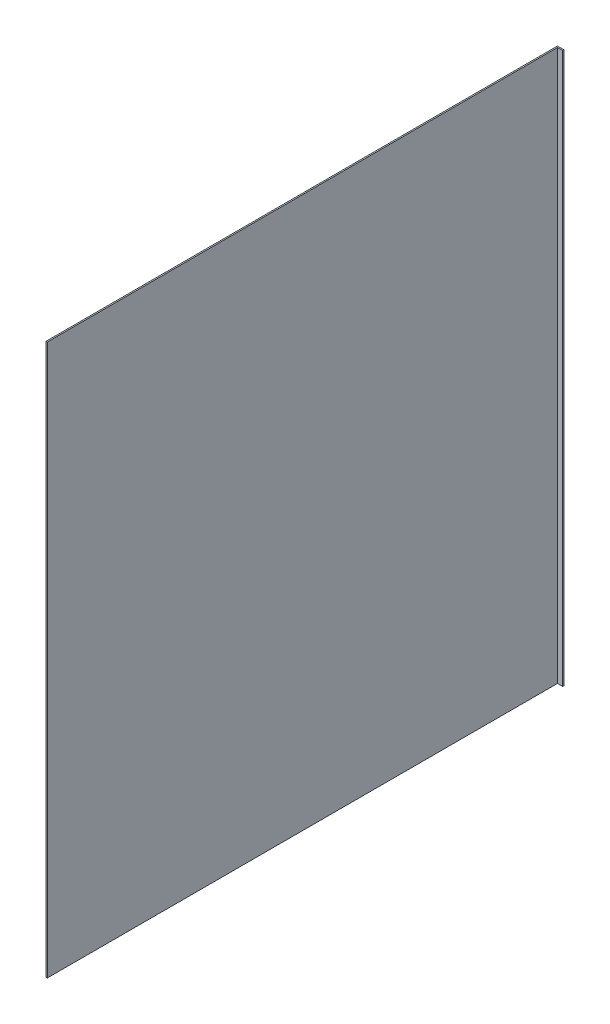
from build123d import *

# Parameters (mm, degrees)
PACK_SARJOR_L_KILAVUZ_1_1_START = 1040
PACK_SARJOR_L_KILAVUZ_1_1_DEPTH = 840


with BuildPart() as part:
    # Sketch1 → PACK_sarjor_L_kilavuz_1_1 (new body)
    with BuildSketch(Plane(origin=(0, 0, 0), x_dir=(1, 0, 0), z_dir=(0, 1, 0)).offset(PACK_SARJOR_L_KILAVUZ_1_1_START)):
        Polygon((140, 800), (150, 800), (150, 798), (142, 798), (142, 20), (140, 20), align=None)
    extrude(amount=PACK_SARJOR_L_KILAVUZ_1_1_DEPTH)


solid = part.part
